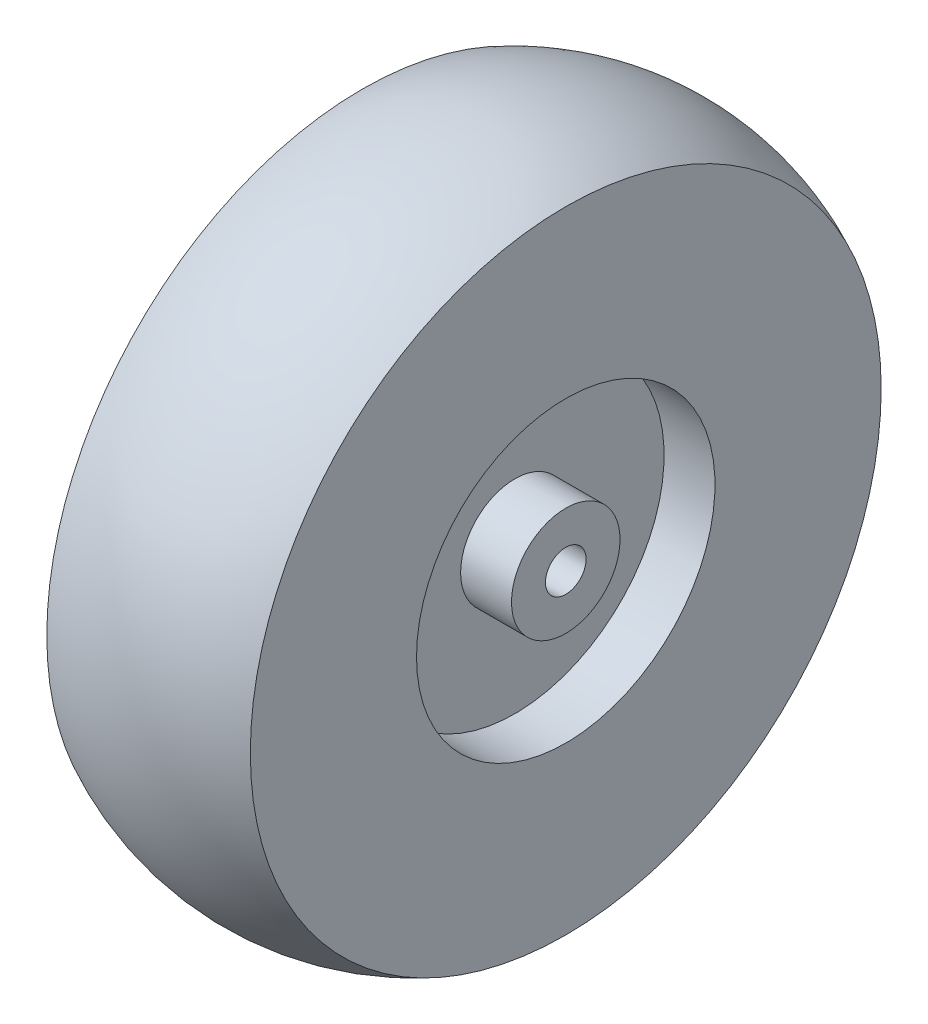
from build123d import *


with BuildPart() as part:
    # Sketch2 → Revolve1 (revolve)
    with BuildSketch(Plane.XY, mode=Mode.PRIVATE) as revolve1_sk:
        with BuildLine():
            Line((-30, 6), (30, 6))
            Line((30, 6), (30, 16))
            Line((30, 16), (15, 16))
            Line((15, 16), (15, 44))
            Line((15, 44), (30, 44))
            Line((30, 44), (30, 93))
            ThreePointArc((30, 93), (0, 100), (-30, 93))
            Line((-30, 93), (-30, 44))
            Line((-30, 44), (-15, 44))
            Line((-15, 44), (-15, 16))
            Line((-15, 16), (-30, 16))
            Line((-30, 16), (-30, 6))
        make_face()
    revolve(revolve1_sk.sketch.rotate(Axis((-108.739304751, 0, 0), (1, 0, 0)), 90), axis=Axis((-108.739304751, 0, 0), (1, 0, 0)))


solid = part.part
